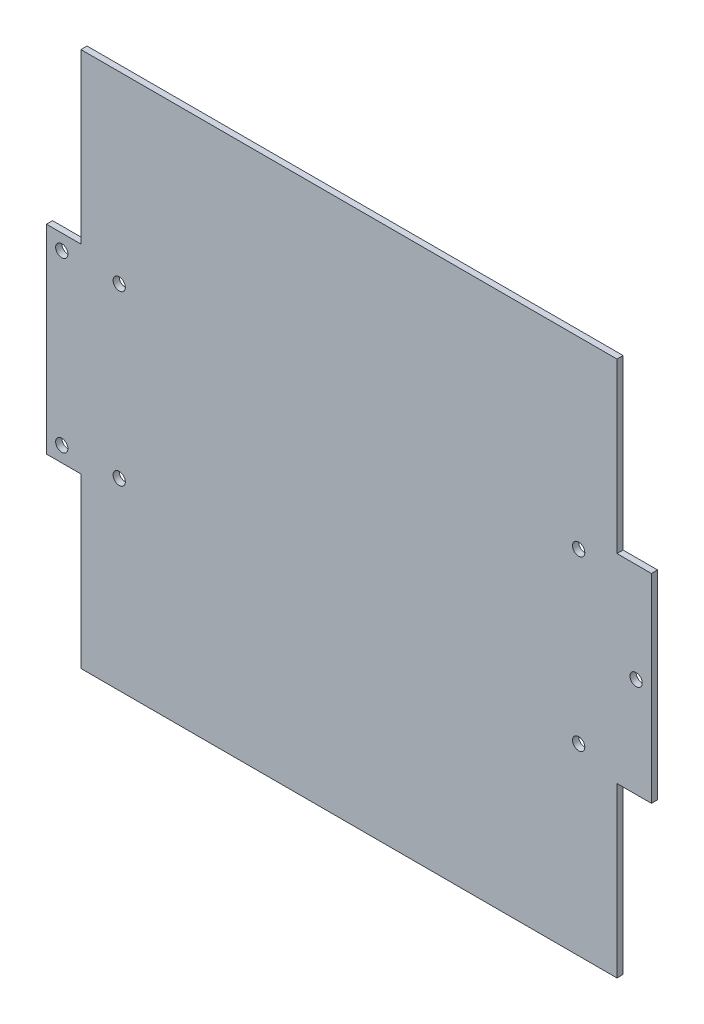
from build123d import *

# Parameters (mm, degrees)
BOSS_EXTRUDE1_DEPTH            = 1.6
F_3_2_3_2_DIAMETER_HOLE1_D     = 3.2
F_3_2_3_2_DIAMETER_HOLE1_DEPTH = 4
F_3_2_3_2_DIAMETER_HOLE1_TIP   = 0.96137699
SKETCH8_R                      = 1.6
CUT_EXTRUDE2_DEPTH             = 205.459189082


with BuildPart() as part:
    # Sketch1 → Boss-Extrude1 (new body)
    with BuildSketch(Plane.XY):
        Polygon((0, 0), (140, 0), (140, 44), (149, 44), (149, 96), (140, 96), (140, 140), (0, 140), (0, 96), (-9, 96), (-9, 44), (0, 44), align=None)
    extrude(amount=BOSS_EXTRUDE1_DEPTH)

    # Ø3.2 (3.2) Diameter Hole1
    with Locations(Plane(origin=(0, 0, 0), x_dir=(-1, 0, 0), z_dir=(0, 0, -1))):
        with Locations((-130, 92), (-130, 48), (-10, 92), (-10, 48)):
            Hole(F_3_2_3_2_DIAMETER_HOLE1_D / 2, depth=F_3_2_3_2_DIAMETER_HOLE1_DEPTH)
            with Locations((0, 0, -(F_3_2_3_2_DIAMETER_HOLE1_DEPTH + F_3_2_3_2_DIAMETER_HOLE1_TIP / 2))):  # 118° drill point
                Cone(0, F_3_2_3_2_DIAMETER_HOLE1_D / 2, F_3_2_3_2_DIAMETER_HOLE1_TIP, mode=Mode.SUBTRACT)

    # Sketch8 → Cut-Extrude2 (cut, through all)
    with BuildSketch(Plane.XY.offset(1.6)):
        with Locations((-5, 92)):
            Circle(SKETCH8_R)
        with Locations((-5, 48)):
            Circle(SKETCH8_R)
        with Locations((145, 70)):
            Circle(SKETCH8_R)
    extrude(amount=-CUT_EXTRUDE2_DEPTH, mode=Mode.SUBTRACT)


solid = part.part
